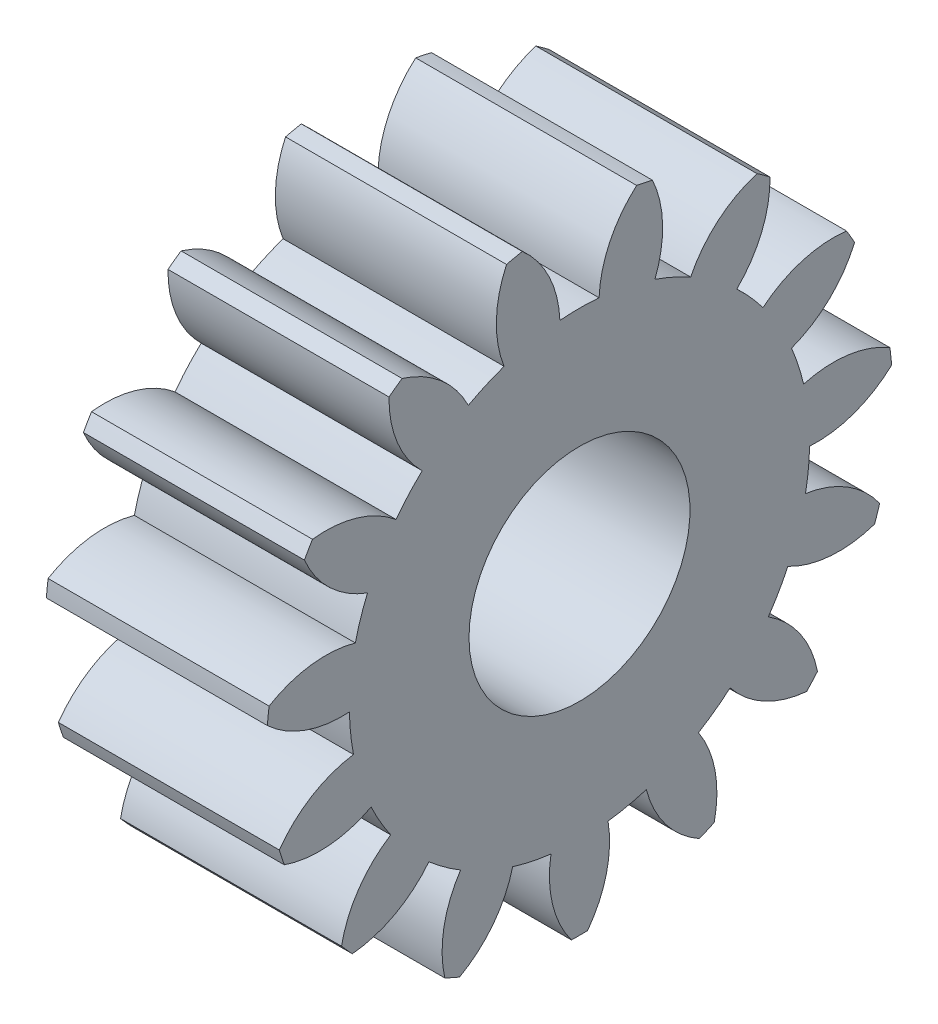
from build123d import *

# Parameters (mm, degrees)
BASPROSKE_W     = 3
BASPROSKE_H     = 4.25
TOOTHCUT_DEPTH  = 7.717514421
TEETHCUTS_COUNT = 15
TEETHCUTS_ANGLE = 336
BORSKE_R        = 1.5
BORE_DEPTH      = 50.0000508


with BuildPart() as part:
    # BasProSke → Base-Revolve (revolve)
    with BuildSketch(Plane(origin=(0, 0, 0), x_dir=(1, 0, 0), z_dir=(0, 1, 0)), mode=Mode.PRIVATE) as base_revolve_sk:
        with Locations((1.5, 2.125)):
            Rectangle(BASPROSKE_W, BASPROSKE_H)
    revolve(base_revolve_sk.sketch.rotate(Axis((-10, 0, 0), (1, 0, 0)), 180), axis=Axis((-10, 0, 0), (1, 0, 0)))

    # TooCutSke → ToothCut (cut, through all)
    with BuildSketch(Plane(origin=(0, 0, 0), x_dir=(0, 0, -1), z_dir=(1, 0, 0))):
        with BuildLine():
            ThreePointArc((0.265767165, 3.112674704), (0, 3.124), (-0.265767165, 3.112674704))
            ThreePointArc((-0.265767165, 3.112674704), (-0.418628877, 3.712626775), (-0.800767345, 4.19974009))
            ThreePointArc((-0.800767345, 4.19974009), (0, 4.2754), (0.800767345, 4.19974009))
            ThreePointArc((0.800767345, 4.19974009), (0.418628877, 3.712626775), (0.265767165, 3.112674704))
        make_face()
    toothcut = extrude(amount=TOOTHCUT_DEPTH, mode=Mode.SUBTRACT)

    # TeethCuts: ToothCut ×15 about axis
    teethcuts_axis = Axis((-10, 0, 0), (1, 0, 0))
    for i in range(1, TEETHCUTS_COUNT):
        add(toothcut.rotate(teethcuts_axis, i * TEETHCUTS_ANGLE / (TEETHCUTS_COUNT - 1)), mode=Mode.SUBTRACT)

    # BorSke → Bore (cut, symmetric)
    with BuildSketch(Plane(origin=(0, 0, 0), x_dir=(0, 0, -1), z_dir=(1, 0, 0))):
        with Locations(Location((0, 0, 0), (0, 0, 180))):
            Circle(BORSKE_R)
    extrude(amount=BORE_DEPTH, both=True, mode=Mode.SUBTRACT)


solid = part.part
